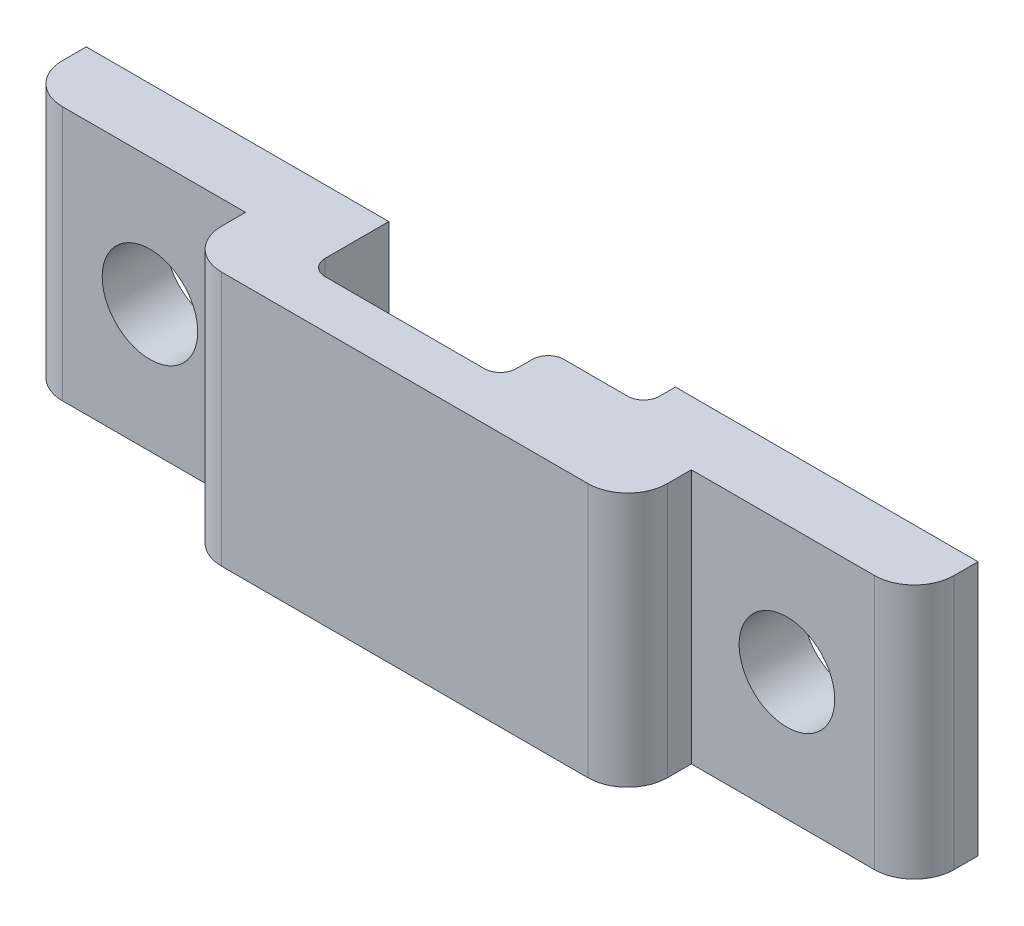
from build123d import *

# Parameters (mm, degrees)
SKETCH1_W           = 35.56
SKETCH1_H           = 10.16
SKETCH1_R           = 1.905
BOSS_EXTRUDE1_DEPTH = 5.08
SKETCH2_W           = 8.89
SKETCH2_H           = 2.54
CUT_EXTRUDE1_DEPTH  = 22.098824612
FILLET1_R           = 1.5875
FILLET2_R           = 0.635


with BuildPart() as part:
    # Sketch1 → Boss-Extrude1 (new body)
    with BuildSketch(Plane.XY):
        Rectangle(SKETCH1_W, SKETCH1_H)
        with Locations((-12.7, 0)):
            Circle(SKETCH1_R, mode=Mode.SUBTRACT)
        with Locations((12.7, 0)):
            Circle(SKETCH1_R, mode=Mode.SUBTRACT)
    extrude(amount=BOSS_EXTRUDE1_DEPTH)

    # Sketch2 → Cut-Extrude1 (cut, through all)
    with BuildSketch(Plane.XZ.offset(5.08)):
        Polygon((0, 0), (-5.715, 0), (-5.715, 3.175), (1.905, 3.175), (1.905, 1.27), (5.715, 1.27), (5.715, 0), align=None)
        with Locations((-13.335, 3.81)):
            Rectangle(SKETCH2_W, SKETCH2_H)
        with Locations((13.335, 3.81)):
            Rectangle(SKETCH2_W, SKETCH2_H)
    extrude(amount=-CUT_EXTRUDE1_DEPTH, mode=Mode.SUBTRACT)

    # Fillet1
    fillet1_edges = [part.edges().sort_by_distance(p)[0] for p in [
        (-17.78, 0, 2.54),
        (-8.89, 0, 5.08),
        (8.89, 0, 5.08),
        (17.78, 0, 2.54),
    ]]
    fillet(fillet1_edges, radius=FILLET1_R)

    # Fillet2
    fillet2_edges = [part.edges().sort_by_distance(p)[0] for p in [
        (-5.715, 0, 3.175),
        (1.905, 0, 3.175),
        (1.905, 0, 1.27),
        (5.715, 0, 1.27),
    ]]
    fillet(fillet2_edges, radius=FILLET2_R)


solid = part.part
